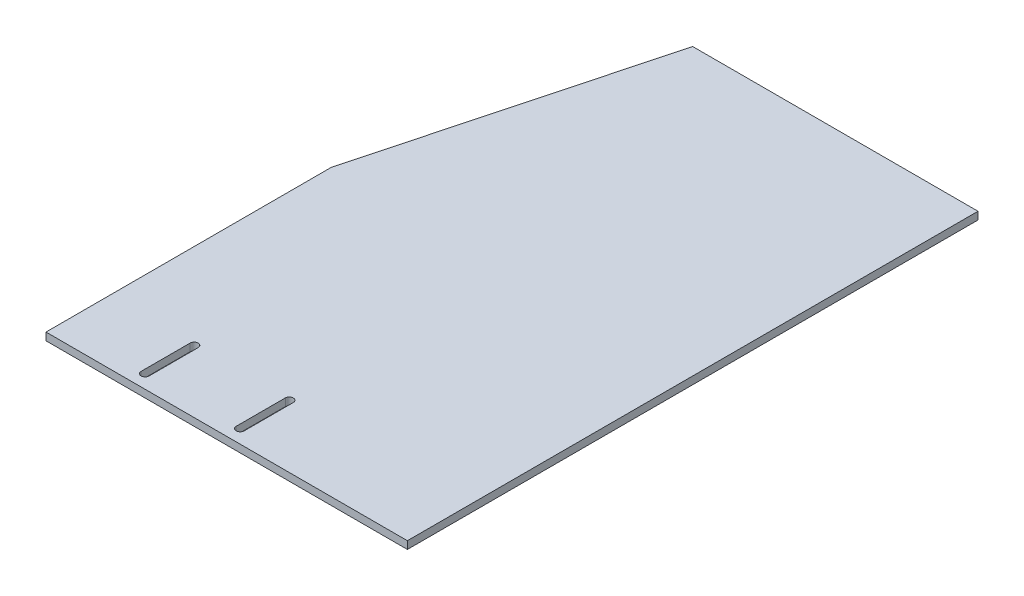
from build123d import *

# Parameters (mm, degrees)
BOSS_EXTRUDE1_DEPTH = 4


with BuildPart() as part:
    # Sketch1 → Boss-Extrude1 (new body)
    with BuildSketch(Plane(origin=(0, 0, 0), x_dir=(-1, 0, 0), z_dir=(0, 1, 0))):
        Polygon((0, 0), (0, 150), (-190, 150), (-190, -150), (-40, -150), align=None)
        with BuildLine():
            Line((-97.1, 142.9), (-97.1, 117.1))
            ThreePointArc((-97.1, 117.1), (-95, 115), (-92.9, 117.1))
            Line((-92.9, 117.1), (-92.9, 142.9))
            ThreePointArc((-92.9, 142.9), (-95, 145), (-97.1, 142.9))
        make_face(mode=Mode.SUBTRACT)
        with BuildLine():
            Line((-42.9, 142.9), (-42.9, 117.1))
            ThreePointArc((-42.9, 117.1), (-45, 115), (-47.1, 117.1))
            Line((-47.1, 117.1), (-47.1, 142.9))
            ThreePointArc((-47.1, 142.9), (-45, 145), (-42.9, 142.9))
        make_face(mode=Mode.SUBTRACT)
    extrude(amount=BOSS_EXTRUDE1_DEPTH)


solid = part.part
